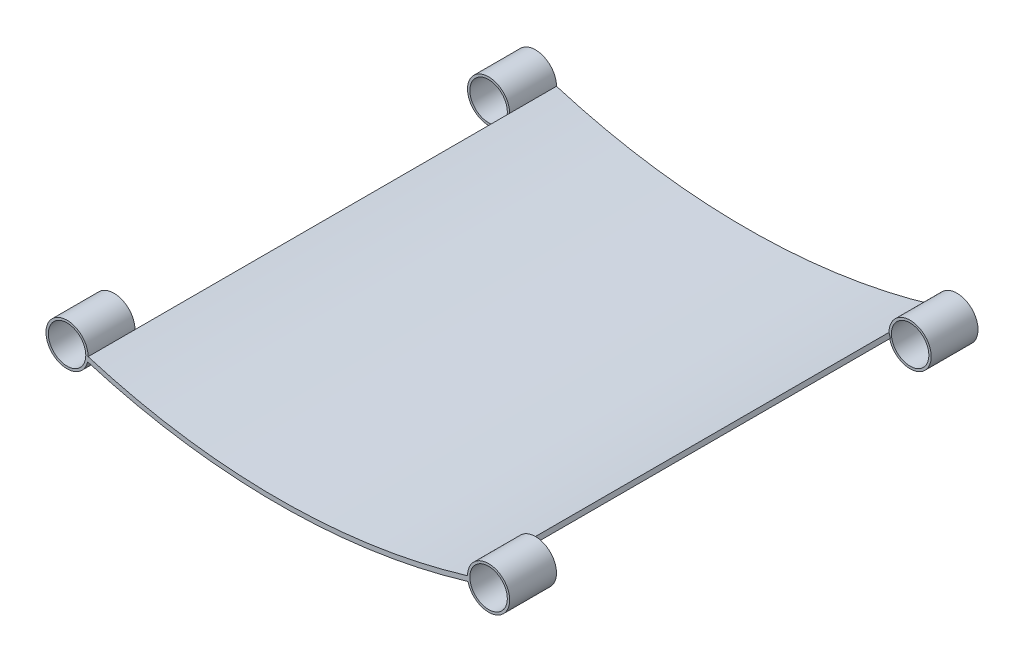
from build123d import *

# Parameters (mm, degrees)
SKETCH1_R             = 4.5
SKETCH1_R_2           = 4
BOSS_EXTRUDE1_DEPTH   = 10
BOSS_EXTRUDE1_2_DEPTH = 10
BOSS_EXTRUDE4_DEPTH   = 100
BOSS_EXTRUDE5_START   = -10
SKETCH4_R             = 4.5
SKETCH4_R_2           = 4
BOSS_EXTRUDE5_DEPTH   = 10


with BuildPart() as part:
    # Sketch1 → Boss-Extrude1 (new body)
    with BuildSketch(Plane.XY):
        with Locations((-45, 0)):
            Circle(SKETCH1_R)
        with Locations((-45, 0)):
            Circle(SKETCH1_R_2, mode=Mode.SUBTRACT)
    extrude(amount=-BOSS_EXTRUDE1_DEPTH)



with BuildPart() as body_2:
    # Sketch1 → Boss-Extrude1 2 (new body)
    with BuildSketch(Plane.XY):
        with Locations((45, 0)):
            Circle(SKETCH1_R)
        with Locations((45, 0)):
            Circle(SKETCH1_R_2, mode=Mode.SUBTRACT)
    extrude(amount=-BOSS_EXTRUDE1_2_DEPTH)


with BuildPart() as part_1:
    add(part.part)

    add(body_2.part)  # Boss-Extrude4 merges body 2
    # Sketch2 → Boss-Extrude4 (add)
    with BuildSketch(Plane.XY):
        with BuildLine():
            Line((-40.5, 0), (-40.789285714, -0.957242799))
            ThreePointArc((-40.789285714, -0.957242799), (0, -6.986008193), (40.789285714, -0.957242799))
            Line((40.789285714, -0.957242799), (40.5, 0))
            ThreePointArc((40.5, 0), (0, -5.986008193), (-40.5, 0))
        make_face()
    extrude(amount=-BOSS_EXTRUDE4_DEPTH)

    # Sketch4 → Boss-Extrude5 (add)
    # profile 1 of 2: a face of its own
    with BuildSketch(Plane(origin=(0, 0, -100), x_dir=(-1, 0, 0), z_dir=(0, 0, -1)).offset(BOSS_EXTRUDE5_START)):
        with Locations((45, 0)):
            Circle(SKETCH4_R)
        with Locations(Location((45, 0, 0), (0, 0, 180))):
            Circle(SKETCH4_R_2, mode=Mode.SUBTRACT)
    # profile 2 of 2: a face of its own
    with BuildSketch(Plane(origin=(0, 0, -100), x_dir=(-1, 0, 0), z_dir=(0, 0, -1)).offset(BOSS_EXTRUDE5_START)):
        with Locations((-45, 0)):
            Circle(SKETCH4_R)
        with Locations(Location((-45, 0, 0), (0, 0, 180))):
            Circle(SKETCH4_R_2, mode=Mode.SUBTRACT)
    extrude(amount=BOSS_EXTRUDE5_DEPTH)


solid = part_1.part
